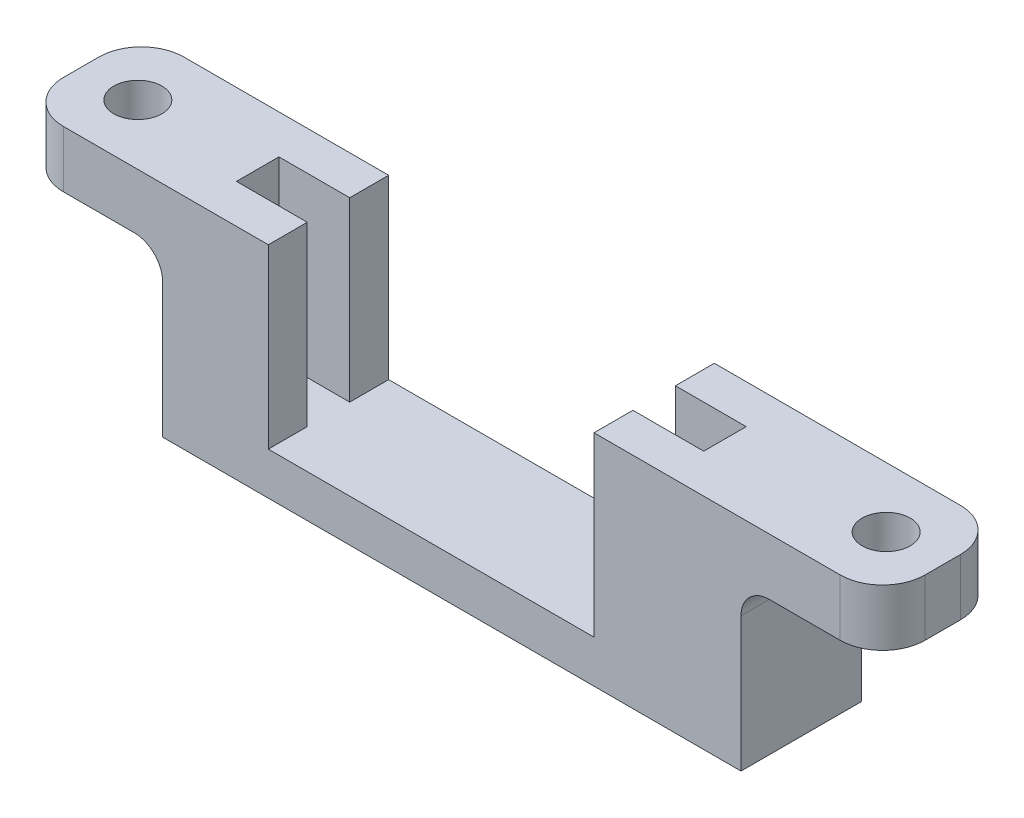
from build123d import *

# Parameters (mm, degrees)
SKETCH1_W           = 60.85
SKETCH1_H           = 8.5
BOSS_EXTRUDE1_DEPTH = 15.5
SKETCH4_R           = 1.7
CUT_EXTRUDE3_DEPTH  = 35.409201168
SKETCH2_W           = 5
SKETCH2_H           = 3
CUT_EXTRUDE1_DEPTH  = 12.5
SKETCH3_W           = 10
SKETCH3_H           = 8.5
CUT_EXTRUDE2_DEPTH  = 11.5
FILLET1_R           = 2
FILLET2_R           = 3


with BuildPart() as part:
    # Sketch1 → Boss-Extrude1 (new body)
    with BuildSketch(Plane(origin=(0, 0, 0), x_dir=(1, 0, 0), z_dir=(0, 1, 0))):
        Rectangle(SKETCH1_W, SKETCH1_H)
    extrude(amount=BOSS_EXTRUDE1_DEPTH)

    # Sketch4 → Cut-Extrude3 (cut, through all)
    with BuildSketch(Plane(origin=(0, 15.5, 0), x_dir=(1, 0, 0), z_dir=(0, 1, 0))):
        with Locations(Location((-26.425, 0, 0), (0, 0, 270))):
            Circle(SKETCH4_R)
        with Locations(Location((26.425, 0, 0), (0, 0, 90))):
            Circle(SKETCH4_R)
    extrude(amount=-CUT_EXTRUDE3_DEPTH, mode=Mode.SUBTRACT)

    # Sketch2 → Cut-Extrude1 (cut)
    with BuildSketch(Plane(origin=(0, 15.5, 0), x_dir=(1, 0, 0), z_dir=(0, 1, 0))):
        Polygon((-12.96, -1.5), (-12.96, -4.25), (10.04, -4.25), (10.04, -1.5), (10.04, 1.5), (10.04, 4.25), (-12.96, 4.25), (-12.96, 1.5), align=None)
        with Locations((-15.46, 0)):
            Rectangle(SKETCH2_W, SKETCH2_H)
        with Locations((12.54, 0)):
            Rectangle(SKETCH2_W, SKETCH2_H)
    extrude(amount=-CUT_EXTRUDE1_DEPTH, mode=Mode.SUBTRACT)

    # Sketch3 → Cut-Extrude2 (cut)
    with BuildSketch(Plane.XZ):
        with Locations((-25.425, 0)):
            Rectangle(SKETCH3_W, SKETCH3_H)
        with Locations((25.425, 0)):
            Rectangle(SKETCH3_W, SKETCH3_H)
    extrude(amount=-CUT_EXTRUDE2_DEPTH, mode=Mode.SUBTRACT)

    # Fillet1
    fillet1_edges = [part.edges().sort_by_distance(p)[0] for p in [
        (-20.425, 11.5, 0),
        (20.425, 11.5, 0),
    ]]
    fillet(fillet1_edges, radius=FILLET1_R)

    # Fillet2
    fillet2_edges = [part.edges().sort_by_distance(p)[0] for p in [
        (30.425, 13.5, 4.25),
        (-30.425, 13.5, 4.25),
        (-30.425, 13.5, -4.25),
        (30.425, 13.5, -4.25),
    ]]
    fillet(fillet2_edges, radius=FILLET2_R)


solid = part.part
